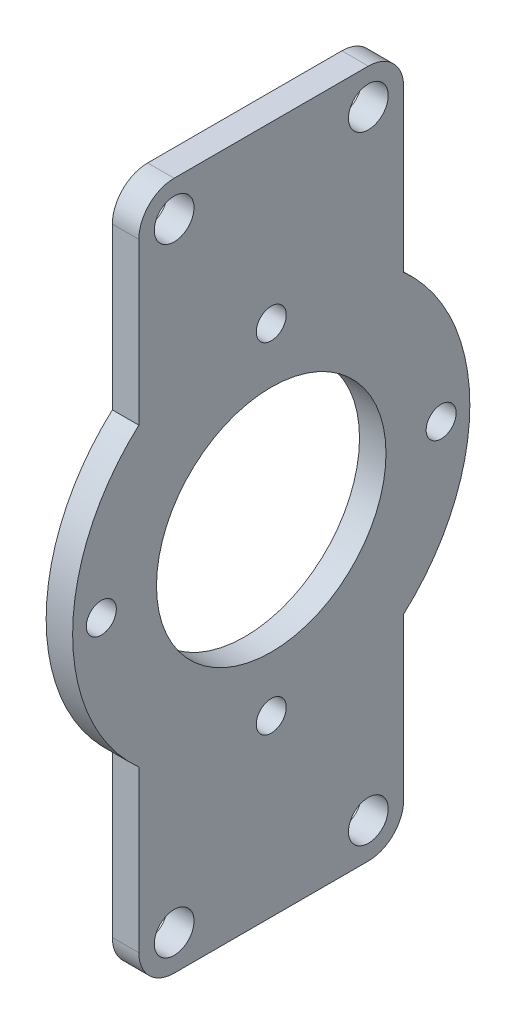
from build123d import *

# Parameters (mm, degrees)
SKETCH_1_W          = 3
SKETCH_1_H          = 30
EXTRUDE_1_DEPTH     = 78
SKETCH_2_R          = 22.5
EXTRUDE_2_DEPTH     = 3
SKETCH_3_R          = 13
CUT_EXTRUDE_1_DEPTH = 87.598210143
HOLE_WIZARD_M31_D   = 3.4
HOLE_WIZARD_M41_D   = 4.5
FILLET_1_R          = 4


with BuildPart() as part:
    # Эскиз1 → Бобышка-Вытянуть1 (new body)
    with BuildSketch(Plane(origin=(0, 0, 0), x_dir=(1, 0, 0), z_dir=(0, 1, 0))):
        with Locations((1.5, -15)):
            Rectangle(SKETCH_1_W, SKETCH_1_H)
    extrude(amount=EXTRUDE_1_DEPTH)

    # Эскиз2 → Бобышка-Вытянуть2 (add)
    with BuildSketch(Plane.ZY):
        with Locations((15, 39)):
            Circle(SKETCH_2_R)
    extrude(amount=-EXTRUDE_2_DEPTH)

    # Эскиз3 → Вырез-Вытянуть1 (cut, through all)
    with BuildSketch(Plane.ZY):
        with Locations((15, 39)):
            Circle(SKETCH_3_R)
    extrude(amount=-CUT_EXTRUDE_1_DEPTH, mode=Mode.SUBTRACT)

    # Отверстие с зазором M31 (through all)
    with Locations(Plane(origin=(3, -25.024735225, 7.262908886), x_dir=(0, 0, 1), z_dir=(1, 0, 0))):
        with Locations((7.737091114, -83.274735225), (-11.512908886, -64.024735225), (7.737091114, -44.774735225), (26.987091114, -64.024735225)):
            Hole(HOLE_WIZARD_M31_D / 2)

    # Отверстие с зазором M41 (through all)
    with Locations(Plane(origin=(3, 0, 0), x_dir=(0, 0, -1), z_dir=(1, 0, 0))):
        with Locations((-26, 74), (-4, 74), (-4, 4), (-26, 4)):
            Hole(HOLE_WIZARD_M41_D / 2)

    # Скругление1
    fillet_1_edges = [part.edges().sort_by_distance(p)[0] for p in [
        (1.5, 78, 0),
        (1.5, 0, 0),
        (1.5, 0, 30),
        (1.5, 78, 30),
    ]]
    fillet(fillet_1_edges, radius=FILLET_1_R)


solid = part.part
